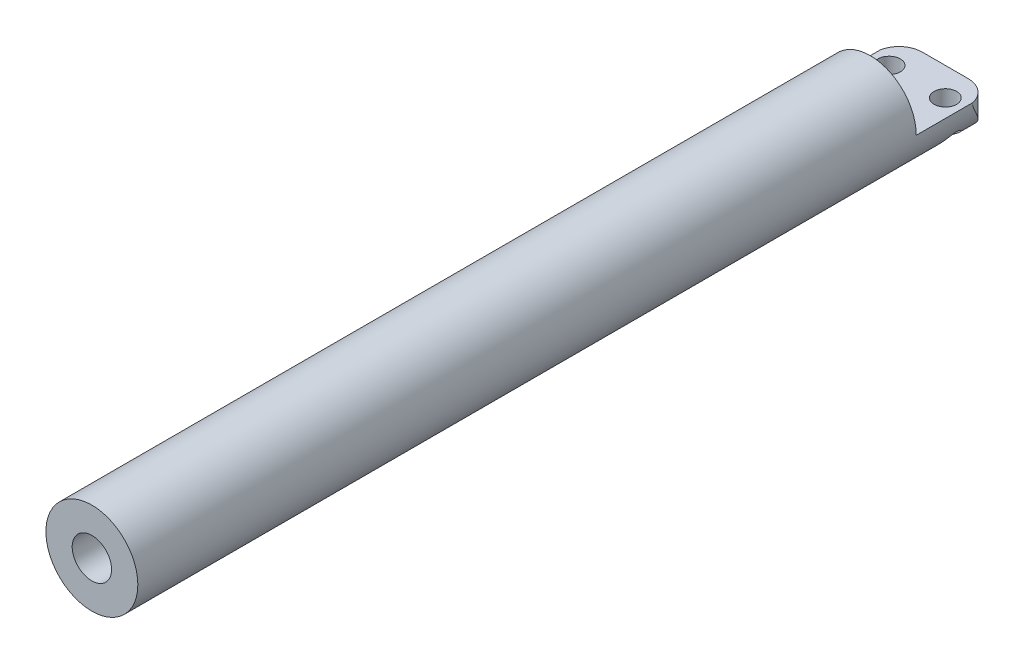
from build123d import *

# Parameters (mm, degrees)
ESBO_O1_R                 = 4.9
RESSALTO_EXTRUS_O1_DEPTH  = 91
FURO_ROSCADO_DE_M51_D     = 4.2
FURO_ROSCADO_DE_M51_DEPTH = 12.7381927
FURO_ROSCADO_DE_M51_TIP   = 1.2618073
CORTE_EXTRUS_O1_DEPTH     = 8
CORTE_EXTRUS_O2_DEPTH     = 92.26346476
FURO_COM_FOLGA_DE_M21_D   = 2.4


with BuildPart() as part:
    # Esboço1 → Ressalto-extrusão1 (new body)
    with BuildSketch(Plane.XY):
        Circle(ESBO_O1_R)
    extrude(amount=RESSALTO_EXTRUS_O1_DEPTH)

    # Furo roscado de M51
    with Locations(Plane.XY.offset(91)):
        with Locations((0, 0)):
            Hole(FURO_ROSCADO_DE_M51_D / 2, depth=FURO_ROSCADO_DE_M51_DEPTH)
            with Locations((0, 0, -(FURO_ROSCADO_DE_M51_DEPTH + FURO_ROSCADO_DE_M51_TIP / 2))):  # 118° drill point
                Cone(0, FURO_ROSCADO_DE_M51_D / 2, FURO_ROSCADO_DE_M51_TIP, mode=Mode.SUBTRACT)

    # Esboço10 → Corte-extrusão1 (cut)
    with BuildSketch(Plane(origin=(0, 0, 0), x_dir=(-1, 0, 0), z_dir=(0, 0, -1))):
        with BuildLine():
            Line((-5, 0), (5, 0))
            ThreePointArc((5, 0), (0, 5), (-5, 0))
        make_face()
    extrude(amount=-CORTE_EXTRUS_O1_DEPTH, mode=Mode.SUBTRACT)

    # Esboço18 → Corte-extrusão2 (cut, through all)
    with BuildSketch(Plane(origin=(0, 0, 0), x_dir=(1, 0, 0), z_dir=(0, 1, 0))):
        with BuildLine():
            Line((-4.9, -2.002506281), (-4.9, 0))
            Line((-4.9, 0), (-2.45, 0))
            ThreePointArc((-2.45, 0), (-4.032129215, -0.564317395), (-4.9, -2.002506281))
        make_face()
        with BuildLine():
            Line((2.45, 0), (4.9, 0))
            Line((4.9, 0), (4.9, -2.002506281))
            ThreePointArc((4.9, -2.002506281), (4.032129215, -0.564317395), (2.45, 0))
        make_face()
    extrude(amount=-CORTE_EXTRUS_O2_DEPTH, mode=Mode.SUBTRACT)

    # Furo com folga de M21 (through all)
    with Locations(Plane(origin=(-3, 0, 3), x_dir=(0, 0, 1), z_dir=(0, 1, 0))):
        with Locations((0, 0), (0, 6)):
            Hole(FURO_COM_FOLGA_DE_M21_D / 2)


solid = part.part
